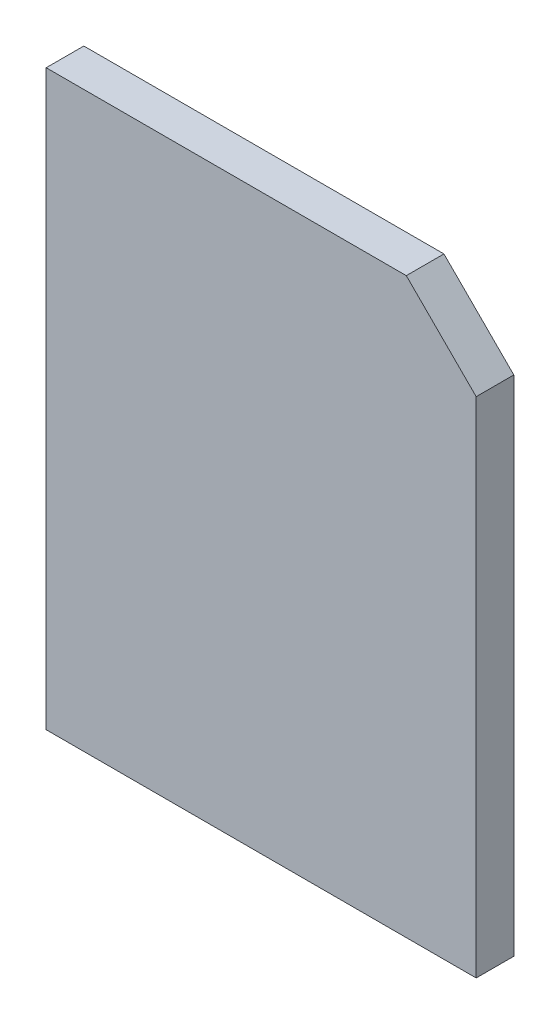
from build123d import *

# Parameters (mm, degrees)
SKETCH1_W           = 24
SKETCH1_H           = 32
BOSS_EXTRUDE1_DEPTH = 1.05
CUT_EXTRUDE1_DEPTH  = 21.109947787


with BuildPart() as part:
    # Sketch1 → Boss-Extrude1 (new, symmetric)
    with BuildSketch(Plane.XY):
        Rectangle(SKETCH1_W, SKETCH1_H)
    extrude(amount=BOSS_EXTRUDE1_DEPTH, both=True)

    # Sketch2 → Cut-Extrude1 (cut, through all)
    with BuildSketch(Plane.XY.offset(1.05)):
        Polygon((12, 16), (8.1, 16), (12, 12.1), align=None)
    extrude(amount=-CUT_EXTRUDE1_DEPTH, mode=Mode.SUBTRACT)


solid = part.part
